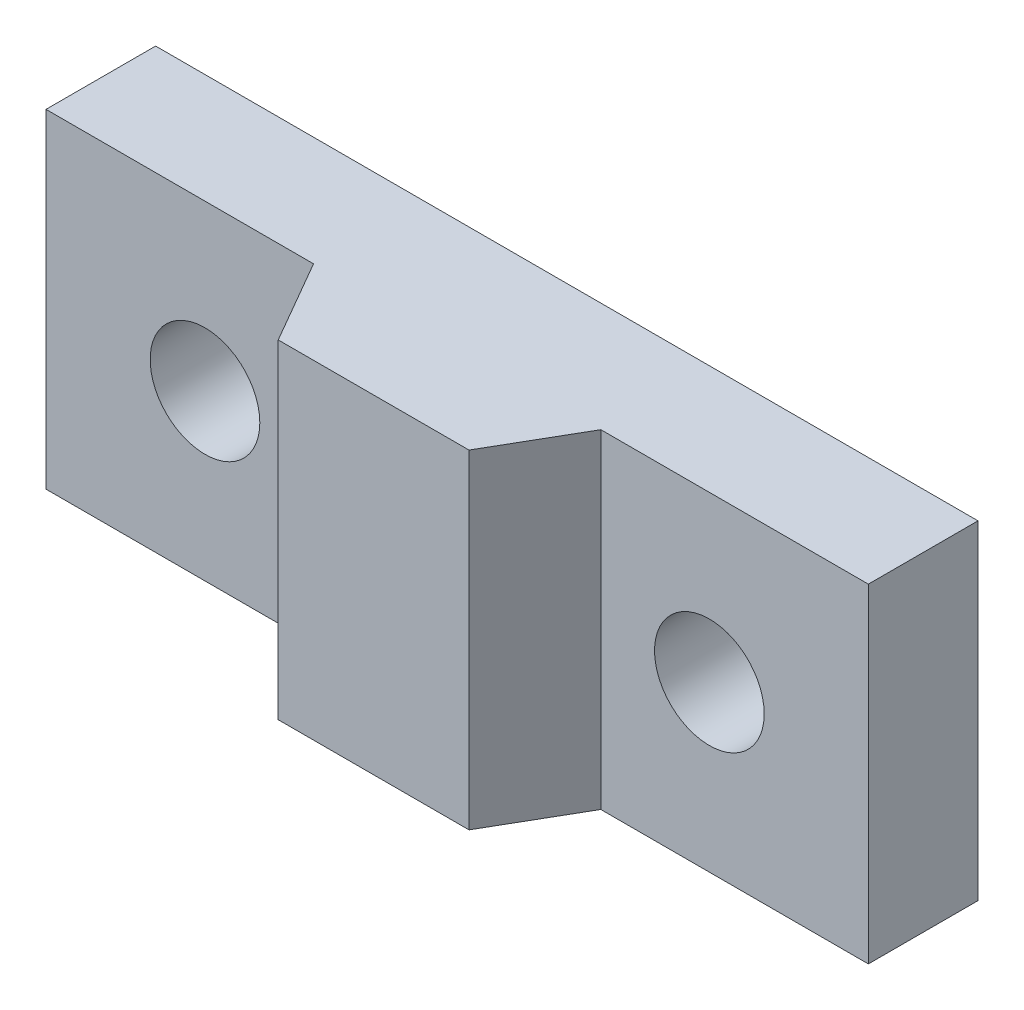
from build123d import *

# Parameters (mm, degrees)
SKETCH1_W           = 6.1976
SKETCH1_H           = 2.54
BOSS_EXTRUDE1_DEPTH = 7.62
CUT_EXTRUDE2_REACH  = 14.993
SKETCH3_R           = 1.27


with BuildPart() as part:
    # Sketch1 → Boss-Extrude1 (new body)
    with BuildSketch(Plane(origin=(0, 0, 0), x_dir=(1, 0, 0), z_dir=(0, 1, 0))):
        Polygon((0, -3.205739983), (0, -1.27), (-3.3274, -1.27), (-2.2098, -3.205739983), align=None)
        Polygon((3.3274, -1.27), (0, -1.27), (0, -3.205739983), (2.2098, -3.205739983), align=None)
        with Locations((6.4262, 0)):
            Rectangle(SKETCH1_W, SKETCH1_H)
        Polygon((-3.3274, -1.27), (0, -1.27), (3.3274, -1.27), (3.3274, 1.27), (-3.3274, 1.27), align=None)
        with Locations((-6.4262, 0)):
            Rectangle(SKETCH1_W, SKETCH1_H)
    extrude(amount=BOSS_EXTRUDE1_DEPTH)

    # Sketch3 → Cut-Extrude2 (cut, up to next)
    with BuildSketch(Plane.XY.offset(3.205739983), mode=Mode.PRIVATE) as cut_extrude2_sk1:
        with Locations((-5.842, 3.81)):
            Circle(SKETCH3_R)
    cut_extrude2_tool1 = extrude(cut_extrude2_sk1.sketch, amount=-CUT_EXTRUDE2_REACH, mode=Mode.PRIVATE) & part.part
    cut_extrude2 = cut_extrude2_tool1.solids().sort_by_distance((-5.842, 3.81, 3.20574))[0]
    add(cut_extrude2, mode=Mode.SUBTRACT)

    # Mirror2: Cut-Extrude2 across plane
    add(cut_extrude2.mirror(Plane(origin=(0, 0, 0), x_dir=(0, 0, 1), z_dir=(1, 0, 0))), mode=Mode.SUBTRACT)


solid = part.part
